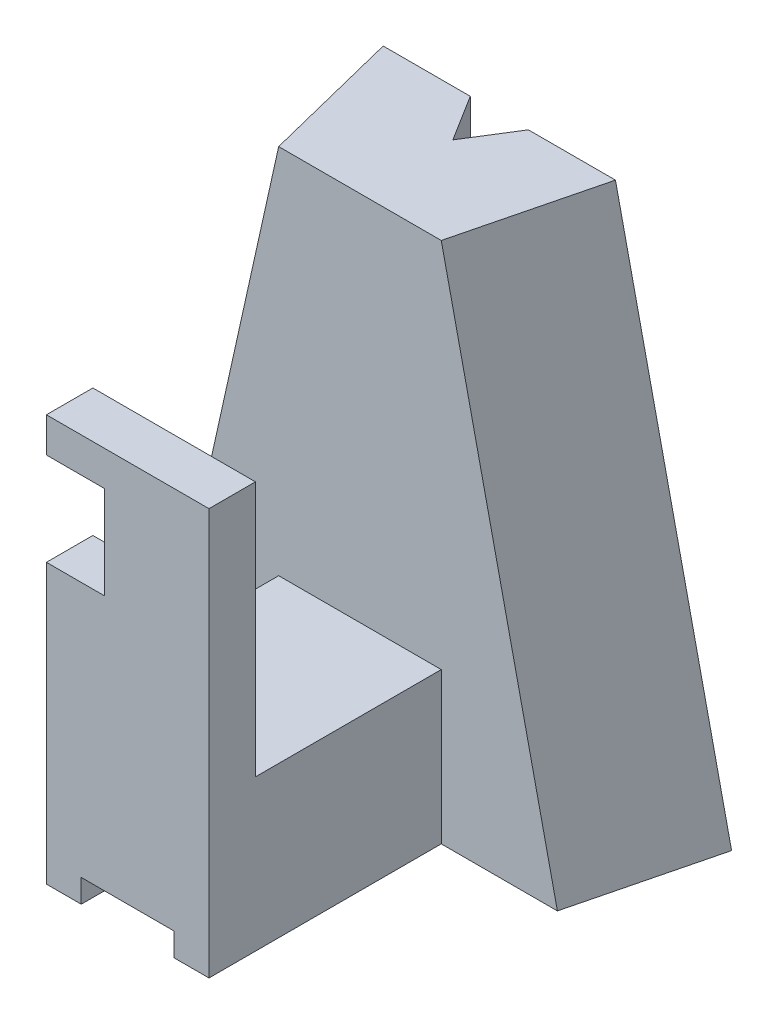
from build123d import *

# Parameters (mm, degrees)
EXTRUDE_1_DEPTH      = 12
CUT_EXTRUDE_1_DEPTH  = 52.946106026
CUT_EXTRUDE_2_DEPTH  = 52.946106026
CUT_EXTRUDE_3_DEPTH  = 51.68530359
EXTRUDE_2_DEPTH      = 7
EXTRUDE_2_DEPTH_BACK = 7
SKETCH_6_W           = 8
SKETCH_6_H           = 2
CUT_EXTRUDE_4_DEPTH  = 5
SKETCH_7_W           = 4
SKETCH_7_H           = 8
CUT_EXTRUDE_5_DEPTH  = 5
SKETCH_8_W           = 5
SKETCH_8_H           = 5
CUT_EXTRUDE_6_DEPTH  = 2


with BuildPart() as part:
    # Эскиз1 → Бобышка-Вытянуть1 (new body)
    with BuildSketch(Plane.XY):
        Polygon((-10, 45), (10, 45), (20, 0), (-20, 0), align=None)
    extrude(amount=EXTRUDE_1_DEPTH)

    # Эскиз2 → Вырез-Вытянуть1 (cut, through all, along a direction that is not the sketch's normal)
    with BuildSketch(Plane.XZ):
        Polygon((-20, 0), (-20, 12), (-17, 12), align=None)
    extrude(amount=-CUT_EXTRUDE_1_DEPTH, dir=(-0.21693045781865616, -0.9761870601839528, 0), mode=Mode.SUBTRACT)

    # Эскиз3 → Вырез-Вытянуть2 (cut, through all, along a direction that is not the sketch's normal)
    with BuildSketch(Plane.XZ):
        Polygon((20, 0), (20, 12), (17, 12), align=None)
    extrude(amount=-CUT_EXTRUDE_2_DEPTH, dir=(0.21693045781865616, -0.9761870601839528, 0), mode=Mode.SUBTRACT)

    # Эскиз4 → Вырез-Вытянуть3 (cut, through all)
    with BuildSketch(Plane(origin=(0, 45, 0), x_dir=(1, 0, 0), z_dir=(0, 1, 0))):
        Polygon((0, 0), (-2.5, 0), (0, -4), (2.5, 0), align=None)
    extrude(amount=-CUT_EXTRUDE_3_DEPTH, mode=Mode.SUBTRACT)

    # Эскиз5 → Бобышка-Вытянуть2 (add, two sides: drawn at the far end of the back side and taken through both)
    with BuildSketch(Plane(origin=(0, 0, 0), x_dir=(0, 0, -1), z_dir=(1, 0, 0)).offset(-EXTRUDE_2_DEPTH_BACK)):
        Polygon((-12, 0), (-32, 0), (-32, 35), (-28, 35), (-28, 13), (-12, 13), align=None)
    extrude(amount=EXTRUDE_2_DEPTH + EXTRUDE_2_DEPTH_BACK)

    # Эскиз6 → Вырез-Вытянуть4 (cut)
    with BuildSketch(Plane.XY.offset(32)):
        with Locations((0, 1)):
            Rectangle(SKETCH_6_W, SKETCH_6_H)
    extrude(amount=-CUT_EXTRUDE_4_DEPTH, mode=Mode.SUBTRACT)

    # Эскиз7 → Вырез-Вытянуть5 (cut)
    with BuildSketch(Plane.ZY.offset(7)):
        with Locations((30, 28)):
            Rectangle(SKETCH_7_W, SKETCH_7_H)
    extrude(amount=-CUT_EXTRUDE_5_DEPTH, mode=Mode.SUBTRACT)

    # Эскиз8 → Вырез-Вытянуть6 (cut)
    with BuildSketch(Plane(origin=(-7, 0, 0), x_dir=(0, 0, -1), z_dir=(1, 0, 0))):
        with Locations((-25.5, 6.5)):
            Rectangle(SKETCH_8_W, SKETCH_8_H)
    extrude(amount=CUT_EXTRUDE_6_DEPTH, mode=Mode.SUBTRACT)


solid = part.part
